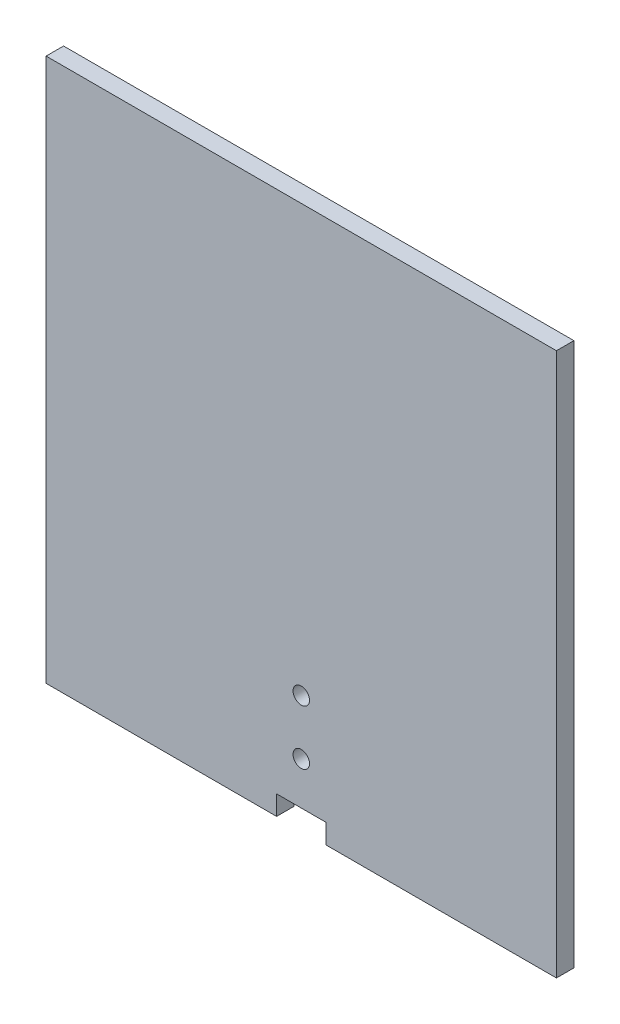
from build123d import *

# Parameters (mm, degrees)
SKETCH1_W           = 93
SKETCH1_H           = 99
BOSS_EXTRUDE1_DEPTH = 3.18
SKETCH2_R           = 1.5
CUT_EXTRUDE1_DEPTH  = 10
SKETCH3_W           = 9
SKETCH3_H           = 3.57
CUT_EXTRUDE2_DEPTH  = 10


with BuildPart() as part:
    # Sketch1 → Boss-Extrude1 (new body)
    with BuildSketch(Plane.XY):
        Rectangle(SKETCH1_W, SKETCH1_H)
    extrude(amount=BOSS_EXTRUDE1_DEPTH)

    # Sketch2 → Cut-Extrude1 (cut)
    with BuildSketch(Plane.XY.offset(3.18)):
        with Locations((0, -38.18)):
            Circle(SKETCH2_R)
        with Locations((0, -28.18)):
            Circle(SKETCH2_R)
    extrude(amount=-CUT_EXTRUDE1_DEPTH, mode=Mode.SUBTRACT)

    # Sketch3 → Cut-Extrude2 (cut)
    with BuildSketch(Plane.XY.offset(3.18)):
        with Locations((0, -47.715)):
            Rectangle(SKETCH3_W, SKETCH3_H)
    extrude(amount=-CUT_EXTRUDE2_DEPTH, mode=Mode.SUBTRACT)


solid = part.part
